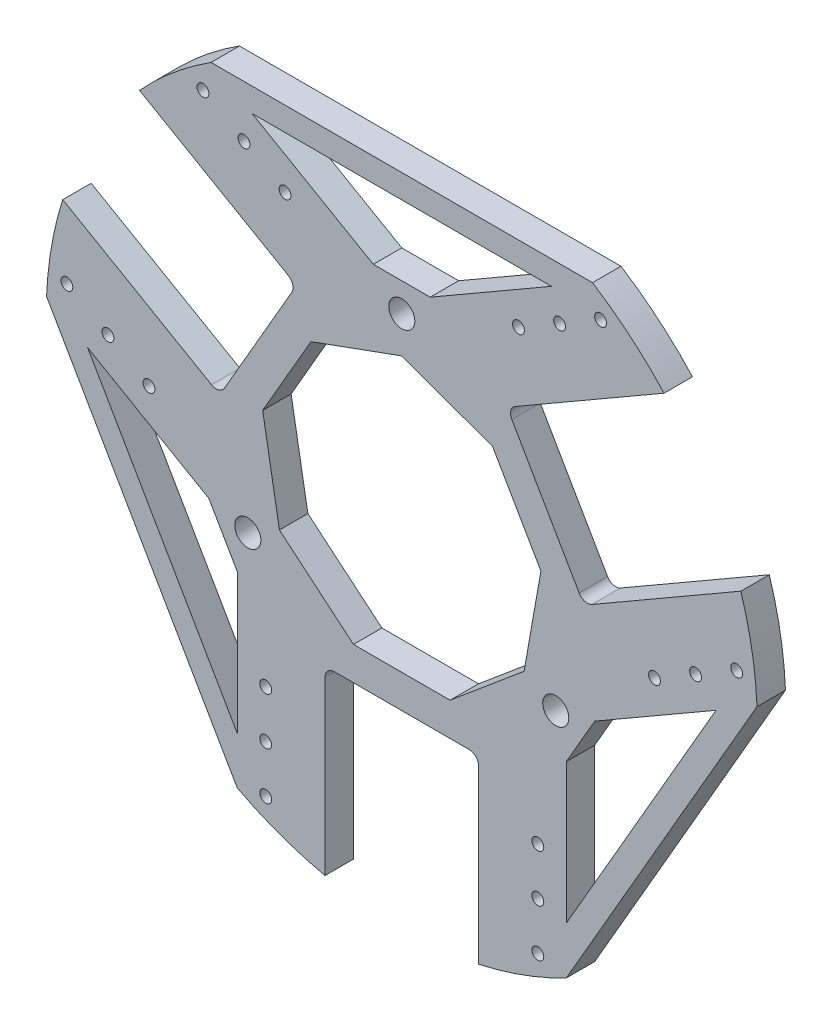
from build123d import *

# Parameters (mm, degrees)
SKETCH_1_R          = 75
SKETCH_1_R_2        = 1.25
EXTRUDE_1_DEPTH     = 6
CUT_EXTRUDE_START   = -10
CUT_EXTRUDE_2_DEPTH = 10
CUT_EXTRUDE_3_DEPTH = 10
EXTRUDE_2_DEPTH     = 6
CUT_EXTRUDE_4_DEPTH = 6
SKETCH_8_R          = 2.75
CUT_EXTRUDE_5_DEPTH = 10


with BuildPart() as part:
    # 草图1 → 凸台-拉伸1 (new body)
    with BuildSketch(Plane.XY):
        Circle(SKETCH_1_R)
        with Locations((28.7, -65)):
            Circle(SKETCH_1_R_2, mode=Mode.SUBTRACT)
        with Locations((28.7, -55)):
            Circle(SKETCH_1_R_2, mode=Mode.SUBTRACT)
        with Locations((28.7, -45)):
            Circle(SKETCH_1_R_2, mode=Mode.SUBTRACT)
        with Locations(Location((-28.7, -45, 0), (0, 0, 180))):
            Circle(SKETCH_1_R_2, mode=Mode.SUBTRACT)
        with Locations(Location((-28.7, -55, 0), (0, 0, 180))):
            Circle(SKETCH_1_R_2, mode=Mode.SUBTRACT)
        with Locations(Location((-28.7, -65, 0), (0, 0, 180))):
            Circle(SKETCH_1_R_2, mode=Mode.SUBTRACT)
        with Locations(Location((-24.62114317, 47.354929089, 0), (0, 0, 180))):
            Circle(SKETCH_1_R_2, mode=Mode.SUBTRACT)
        with Locations(Location((-33.281397208, 52.354929089, 0), (0, 0, 180))):
            Circle(SKETCH_1_R_2, mode=Mode.SUBTRACT)
        with Locations(Location((-41.941651246, 57.354929089, 0), (0, 0, 180))):
            Circle(SKETCH_1_R_2, mode=Mode.SUBTRACT)
        with Locations((-53.32114317, -2.354929089)):
            Circle(SKETCH_1_R_2, mode=Mode.SUBTRACT)
        with Locations((-61.981397208, 2.645070911)):
            Circle(SKETCH_1_R_2, mode=Mode.SUBTRACT)
        with Locations((-70.641651246, 7.645070911)):
            Circle(SKETCH_1_R_2, mode=Mode.SUBTRACT)
        with Locations(Location((53.32114317, -2.354929089, 0), (0, 0, 180))):
            Circle(SKETCH_1_R_2, mode=Mode.SUBTRACT)
        with Locations(Location((61.981397208, 2.645070911, 0), (0, 0, 180))):
            Circle(SKETCH_1_R_2, mode=Mode.SUBTRACT)
        with Locations(Location((70.641651246, 7.645070911, 0), (0, 0, 180))):
            Circle(SKETCH_1_R_2, mode=Mode.SUBTRACT)
        with Locations((24.62114317, 47.354929089)):
            Circle(SKETCH_1_R_2, mode=Mode.SUBTRACT)
        with Locations((33.281397208, 52.354929089)):
            Circle(SKETCH_1_R_2, mode=Mode.SUBTRACT)
        with Locations((41.941651246, 57.354929089)):
            Circle(SKETCH_1_R_2, mode=Mode.SUBTRACT)
    extrude(amount=EXTRUDE_1_DEPTH)

    # 草图3 → 切除-拉伸2 (cut)
    with BuildSketch(Plane.XY.offset(6).offset(CUT_EXTRUDE_START)):
        with BuildLine():
            Line((16.2, -37), (16.2, -73.229502251))
            ThreePointArc((16.2, -73.229502251), (0, -75), (-16.2, -73.229502251))
            Line((-16.2, -73.229502251), (-16.2, -37))
            ThreePointArc((-16.2, -37), (-15.614213562, -35.585786438), (-14.2, -35))
            Line((-14.2, -35), (14.2, -35))
            ThreePointArc((14.2, -35), (15.614213562, -35.585786438), (16.2, -37))
        make_face()
        with BuildLine():
            Line((-23.94293994, 32.529611541), (-55.318609256, 50.644362667))
            ThreePointArc((-55.318609256, 50.644362667), (-64.951905284, 37.5), (-71.518609256, 22.585139584))
            Line((-71.518609256, 22.585139584), (-40.14293994, 4.470388459))
            ThreePointArc((-40.14293994, 4.470388459), (-38.62530185, 4.270587614), (-37.410889132, 5.202439266))
            Line((-37.410889132, 5.202439266), (-23.210889132, 29.797560734))
            ThreePointArc((-23.210889132, 29.797560734), (-23.011088287, 31.315198824), (-23.94293994, 32.529611541))
        make_face()
        with BuildLine():
            Line((40.14293994, 4.470388459), (71.518609256, 22.585139584))
            ThreePointArc((71.518609256, 22.585139584), (64.951905284, 37.5), (55.318609256, 50.644362667))
            Line((55.318609256, 50.644362667), (23.94293994, 32.529611541))
            ThreePointArc((23.94293994, 32.529611541), (23.011088287, 31.315198824), (23.210889132, 29.797560734))
            Line((23.210889132, 29.797560734), (37.410889132, 5.202439266))
            ThreePointArc((37.410889132, 5.202439266), (38.62530185, 4.270587614), (40.14293994, 4.470388459))
        make_face()
    extrude(amount=CUT_EXTRUDE_2_DEPTH, mode=Mode.SUBTRACT)

    # 草图5 → 切除-拉伸3 (cut)
    with BuildSketch(Plane.XY.offset(6).offset(CUT_EXTRUDE_START)):
        with BuildLine():
            Line((-40.231963322, 63.296043536), (-6, 43.532210297))
            Line((-6, 43.532210297), (6, 43.532210297))
            Line((6, 43.532210297), (40.231963322, 63.296043536))
            ThreePointArc((40.231963322, 63.296043536), (0, 75), (-40.231963322, 63.296043536))
        make_face()
        with BuildLine():
            Line((74.931963322, 3.193880513), (40.7, -16.569952726))
            Line((40.7, -16.569952726), (34.7, -26.962257571))
            Line((34.7, -26.962257571), (34.7, -66.489924049))
            ThreePointArc((34.7, -66.489924049), (64.951905284, -37.5), (74.931963322, 3.193880513))
        make_face()
        with BuildLine():
            Line((-34.7, -66.489924049), (-34.7, -26.962257571))
            Line((-34.7, -26.962257571), (-40.7, -16.569952726))
            Line((-40.7, -16.569952726), (-74.931963322, 3.193880513))
            ThreePointArc((-74.931963322, 3.193880513), (-64.951905284, -37.5), (-34.7, -66.489924049))
        make_face()
    extrude(amount=CUT_EXTRUDE_3_DEPTH, mode=Mode.SUBTRACT)

    # 草图6 → 凸台-拉伸2 (add)
    with BuildSketch(Plane.XY.offset(6)):
        Polygon((-74.931963322, 3.193880513), (-34.7, -66.489924049), (-34.7, -56.489924049), (-66.271709284, -1.806119487), align=None)
        Polygon((31.571709284, 58.296043536), (40.231963322, 63.296043536), (-40.231963322, 63.296043536), (-31.571709284, 58.296043536), align=None)
        Polygon((34.7, -56.489924049), (34.7, -66.489924049), (74.931963322, 3.193880513), (66.271709284, -1.806119487), align=None)
    extrude(amount=-EXTRUDE_2_DEPTH)

    # 草图7 → 切除-拉伸4 (cut)
    with BuildSketch(Plane.XY.offset(6)):
        Polygon((-25.804939583, -14.898488815), (-10.191166559, -28), (10.191166559, -28), (25.804939583, -14.898488815), (29.344294586, 5.174190865), (19.153128026, 22.825809135), (0, 29.796977629), (-19.153128026, 22.825809135), (-29.344294586, 5.174190865), align=None)
    extrude(amount=-CUT_EXTRUDE_4_DEPTH, mode=Mode.SUBTRACT)

    # 草图8 → 切除-拉伸5 (cut)
    with BuildSketch(Plane.XY.offset(6)):
        with Locations((0, 37.5)):
            Circle(SKETCH_8_R)
        with Locations((32.475952642, -18.75)):
            Circle(SKETCH_8_R)
        with Locations((-32.475952642, -18.75)):
            Circle(SKETCH_8_R)
    extrude(amount=-CUT_EXTRUDE_5_DEPTH, mode=Mode.SUBTRACT)


solid = part.part
